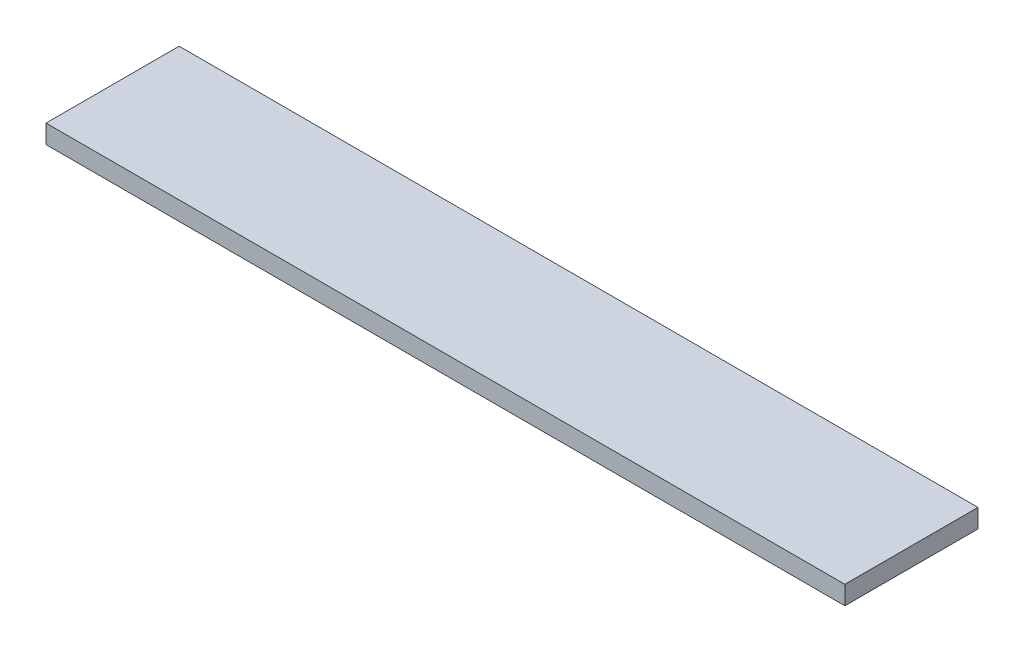
from build123d import *

# Parameters (mm, degrees)
SKETCH1_W           = 30
SKETCH1_H           = 5
BOSS_EXTRUDE1_DEPTH = 0.7


with BuildPart() as part:
    # Sketch1 → Boss-Extrude1 (new body)
    with BuildSketch(Plane(origin=(0, 0, 0), x_dir=(1, 0, 0), z_dir=(0, 1, 0))):
        Rectangle(SKETCH1_W, SKETCH1_H)
    extrude(amount=BOSS_EXTRUDE1_DEPTH)


solid = part.part
